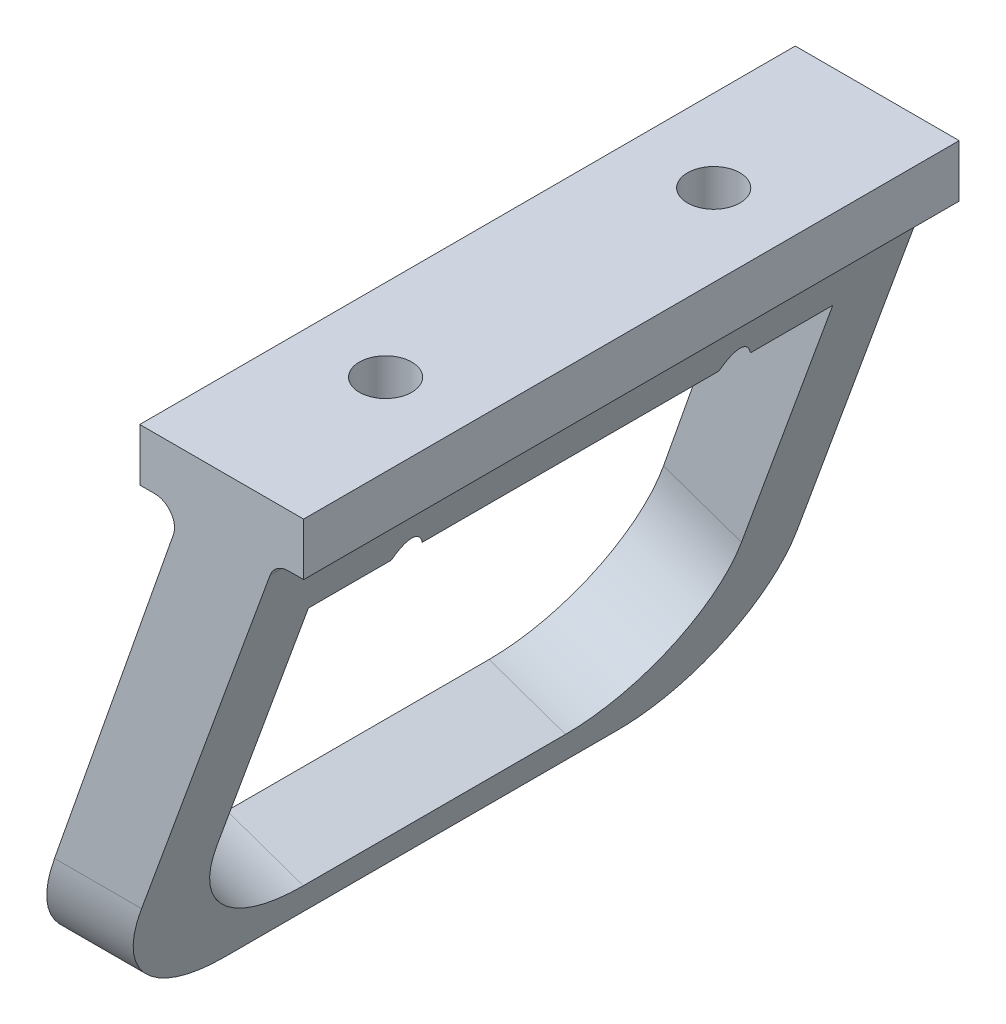
from build123d import *

# Parameters (mm, degrees)
BOSS_EXTRUDE2_DEPTH   = 100
CUT_EXTRUDE1_DEPTH    = 127.933135767
FILLET1_R             = 20
F_1_0MM_DOWEL_HOLE2_D = 8


with BuildPart() as part:
    # Sketch1 → Boss-Extrude2 (new body)
    with BuildSketch(Plane.XY):
        with BuildLine():
            Line((0, 0), (0, 8))
            Line((0, 8), (25, 8))
            Line((25, 8), (25, 0))
            Line((25, 0), (22.7, 0))
            ThreePointArc((22.7, 0), (20.979270691, -0.542543867), (19.880922138, -1.97393957))
            Line((19.880922138, -1.97393957), (-7, -75.828666157))
            Line((-7, -75.828666157), (-20, -75.828666157))
            Line((-20, -75.828666157), (5.131717491, -3.99064426))
            ThreePointArc((5.131717491, -3.99064426), (4.746623467, -1.263902765), (2.3, 0))
            Line((2.3, 0), (0, 0))
        make_face()
    extrude(amount=-BOSS_EXTRUDE2_DEPTH)

    # Sketch3 → Cut-Extrude1 (cut, through all)
    with BuildSketch(Plane(origin=(5.815996282, -2.03466036, 0), x_dir=(0, 0, 1), z_dir=(-0.9439058304641529, 0.33021475317704674, 0))):
        with BuildLine():
            Line((-90, -7.448753356), (-10, -7.448753356))
            Line((-10, -7.448753356), (-10, -48.179415166))
            ThreePointArc((-10, -48.179415166), (-15.857864376, -62.321550789), (-30, -68.179415166))
            Line((-30, -68.179415166), (-70, -68.179415166))
            ThreePointArc((-70, -68.179415166), (-84.142135624, -62.321550789), (-90, -48.179415166))
            Line((-90, -48.179415166), (-90, -7.448753356))
        make_face()
    extrude(amount=-CUT_EXTRUDE1_DEPTH, mode=Mode.SUBTRACT)

    # Fillet1
    fillet1_edges = [part.edges().sort_by_distance(p)[0] for p in [
        (-13.5, -75.828666157, -100),
        (-13.5, -75.828666157, 0),
    ]]
    fillet(fillet1_edges, radius=FILLET1_R)

    # Ø1.0mm Dowel Hole2 (through all)
    with Locations(Plane(origin=(0, 8, 0), x_dir=(1, 0, 0), z_dir=(0, 1, 0))):
        with Locations((12.52505341, 75.033294682), (12.5, 25), (52.497529088, 47.667377925)):
            Hole(F_1_0MM_DOWEL_HOLE2_D / 2)


solid = part.part
